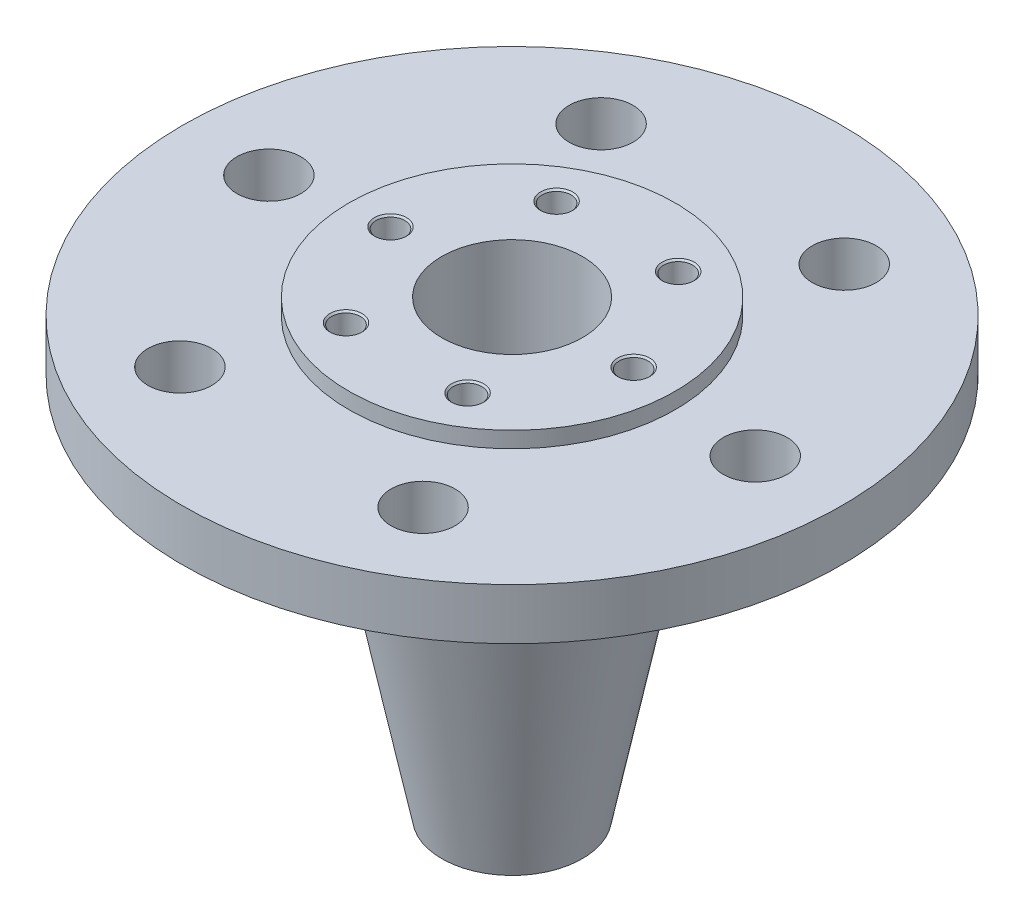
from build123d import *

# Parameters (mm, degrees)
HOLE1_D           = 20
CIRPATTERN1_COUNT = 6
CIRPATTERN2_COUNT = 6


with BuildPart() as part:
    # Sketch1 → Revolve1 (revolve)
    with BuildSketch(Plane.XY, mode=Mode.PRIVATE) as revolve1_sk:
        Polygon((22, 0), (44, 110), (54, 110), (54, 120), (103, 120), (103, 136), (51, 136), (51, 141), (0, 141), (0, 0), align=None)
    revolve(revolve1_sk.sketch.rotate(Axis((0, 141, 0), (0, -1, 0)), 180), axis=Axis((0, 141, 0), (0, -1, 0)))

    # Sketch2 → Cut-Revolve1 (revolve, cut)
    with BuildSketch(Plane.XY, mode=Mode.PRIVATE) as cut_revolve1_sk:
        Polygon((0, 0), (11.414348642, 0), (11.414348642, 38), (16, 42.585651358), (16, 54.752962034), (11, 58), (11, 75), (22, 86), (22, 141), (0, 141), align=None)
    revolve(cut_revolve1_sk.sketch.rotate(Axis((0, 141, 0), (0, -1, 0)), 180), axis=Axis((0, 141, 0), (0, -1, 0)), mode=Mode.SUBTRACT)

    # Hole1 (through all)
    with Locations(Plane(origin=(0, 136, 0), x_dir=(1, 0, 0), z_dir=(0, 1, 0))):
        with Locations((76, 0)):
            hole1 = Hole(HOLE1_D / 2)

    # CirPattern1: Hole1 ×6 about axis
    cirpattern1_axis = Axis((0, 0, 0), (0, 1, 0))
    for i in range(1, CIRPATTERN1_COUNT):
        add(hole1.rotate(cirpattern1_axis, i * 360 / CIRPATTERN1_COUNT), mode=Mode.SUBTRACT)

    # Sketch9 → M10x1.0 Tapped Hole5 (revolve, cut)
    with BuildSketch(Plane(origin=(38, 141, 0), x_dir=(0, 0, 1), z_dir=(1, 0, 0))):
        Polygon((0, 0), (0, 17.703872786), (4.5, 15), (4.5, 0.525), (5.025, 0), align=None)
    m10x1_0_tapped_hole5 = revolve(axis=Axis((38, 147.35, 0), (0, -1, 0)), mode=Mode.SUBTRACT)

    # CirPattern2: M10x1.0 Tapped Hole5 ×6 about axis
    cirpattern2_axis = Axis((0, 0, 0), (0, 1, 0))
    for i in range(1, CIRPATTERN2_COUNT):
        add(m10x1_0_tapped_hole5.rotate(cirpattern2_axis, i * 360 / CIRPATTERN2_COUNT), mode=Mode.SUBTRACT)


solid = part.part
